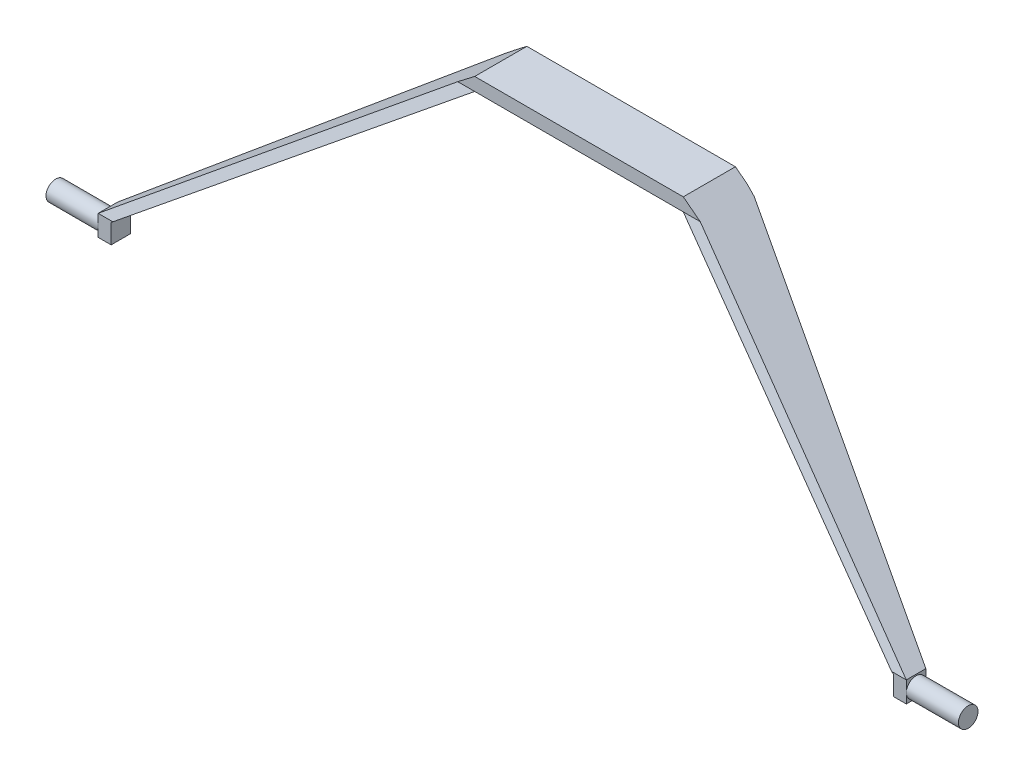
from build123d import *

# Parameters (mm, degrees)
BOSS_EXTRUDE1_DEPTH            = 11.43
BOSS_EXTRUDE1_DEPTH_BACK       = 101.6
CUT_EXTRUDE2_REACH             = 833.724
CUT_EXTRUDE2_DIRECTION_2_REACH = 833.724
CUT_EXTRUDE3_REACH             = 833.724
CUT_EXTRUDE3_DIRECTION_2_REACH = 833.724
BOSS_EXTRUDE3_DEPTH            = 149.606
SKETCH9_R                      = 19.05
BOSS_EXTRUDE4_DEPTH            = 101.6
CUT_EXTRUDE4_REACH             = 936.966
CUT_EXTRUDE4_DIRECTION_2_REACH = 936.966
CUT_EXTRUDE5_REACH             = 936.966
CUT_EXTRUDE5_DIRECTION_2_REACH = 936.966


with BuildPart() as part:
    # Sketch1 → Boss-Extrude1 (new, two sides: drawn at the far end of the back side and taken through both)
    with BuildSketch(Plane.XY.offset(-BOSS_EXTRUDE1_DEPTH_BACK)):
        Polygon((-787.4, -209.55), (-787.471663752, -247.65), (-762.071663752, -247.65), (-762.071663752, -209.55), (-203.2, 215.9), (0, 215.9), (0, 241.3), (-203.2, 241.3), (-787.4, -207.01), align=None)
        Polygon((0, 241.3), (0, 215.9), (203.2, 215.9), (762.071663752, -209.55), (762.071663752, -247.65), (787.471663752, -247.65), (787.4, -209.55), (787.4, -207.01), (203.2, 241.3), align=None)
    extrude(amount=BOSS_EXTRUDE1_DEPTH + BOSS_EXTRUDE1_DEPTH_BACK)

    # Sketch5 → Cut-Extrude2 (cut, up to next)
    with BuildSketch(Plane(origin=(0, 0, 0), x_dir=(0, 0, -1), z_dir=(1, 0, 0)), mode=Mode.PRIVATE) as cut_extrude2_sk1:
        Polygon((-11.43, -209.55), (0, 215.9), (0, 241.3), (-11.43, 241.3), (-11.43, 215.9), align=None)
    cut_extrude2_tool1 = extrude(cut_extrude2_sk1.sketch, amount=-CUT_EXTRUDE2_REACH, mode=Mode.PRIVATE) & part.part
    add(cut_extrude2_tool1.solids().sort_by_distance((0, 90.565111, 7.4168))[0], mode=Mode.SUBTRACT)

    # Sketch5 → Cut-Extrude2 direction 2 (cut, up to next)
    with BuildSketch(Plane(origin=(0, 0, 0), x_dir=(0, 0, -1), z_dir=(1, 0, 0)), mode=Mode.PRIVATE) as cut_extrude2_direction_2_sk1:
        Polygon((-11.43, -209.55), (0, 215.9), (0, 241.3), (-11.43, 241.3), (-11.43, 215.9), align=None)
    cut_extrude2_direction_2_tool1 = extrude(cut_extrude2_direction_2_sk1.sketch, amount=CUT_EXTRUDE2_DIRECTION_2_REACH, mode=Mode.PRIVATE) & part.part
    add(cut_extrude2_direction_2_tool1.solids().sort_by_distance((0, 90.565111, 7.4168))[0], mode=Mode.SUBTRACT)

    # Sketch7 → Cut-Extrude3 (cut, up to next)
    with BuildSketch(Plane(origin=(0, 0, 0), x_dir=(0, 0, -1), z_dir=(1, 0, 0)), mode=Mode.PRIVATE) as cut_extrude3_sk1:
        Polygon((26.67, -209.55), (101.6, 223.982414479), (101.6, -247.65), (26.67, -247.65), align=None)
    cut_extrude3_tool1 = extrude(cut_extrude3_sk1.sketch, amount=-CUT_EXTRUDE3_REACH, mode=Mode.PRIVATE) & part.part
    add(cut_extrude3_tool1.solids().sort_by_distance((0, -89.489932, -74.75645))[0], mode=Mode.SUBTRACT)

    # Sketch7 → Cut-Extrude3 direction 2 (cut, up to next)
    with BuildSketch(Plane(origin=(0, 0, 0), x_dir=(0, 0, -1), z_dir=(1, 0, 0)), mode=Mode.PRIVATE) as cut_extrude3_direction_2_sk1:
        Polygon((26.67, -209.55), (101.6, 223.982414479), (101.6, -247.65), (26.67, -247.65), align=None)
    cut_extrude3_direction_2_tool1 = extrude(cut_extrude3_direction_2_sk1.sketch, amount=CUT_EXTRUDE3_DIRECTION_2_REACH, mode=Mode.PRIVATE) & part.part
    add(cut_extrude3_direction_2_tool1.solids().sort_by_distance((0, -89.489932, -74.75645))[0], mode=Mode.SUBTRACT)

    # Sketch8 → Boss-Extrude3 (add)
    with BuildSketch(Plane.XY):
        Polygon((-787.471663752, -247.65), (-762.071663752, -247.65), (-762.071663752, -209.55), (-203.2, 215.9), (203.2, 215.9), (762.071663752, -209.55), (762.071663752, -247.65), (787.471663752, -247.65), (787.4, -207.01), (203.2, 241.3), (-203.2, 241.3), (-787.4, -207.01), align=None)
    extrude(amount=BOSS_EXTRUDE3_DEPTH)

    # Sketch9 → Boss-Extrude4 (add)
    with BuildSketch(Plane(origin=(787.032515479, 1.387837182, 0), x_dir=(0, 0, -1), z_dir=(0.9999984452495948, 0.0017633769855495952, 0))):
        with Locations(Location((-130.556, -229.988224375, 0), (0, 0, 270))):
            Circle(SKETCH9_R)
    boss_extrude4 = extrude(amount=BOSS_EXTRUDE4_DEPTH)

    # Mirror1: Boss-Extrude4 across plane
    add(boss_extrude4.mirror(Plane(origin=(0, 0, 0), x_dir=(0, 0, 1), z_dir=(1, 0, 0))))

    # Cut-Extrude4: up to this face of the body (flat: up to its plane)
    cut_extrude4_end = Plane(part.part.faces().sort_by_distance((-477.863853052, 30.525347549, 40.754880745))[0])
    # Sketch10 → Cut-Extrude4 (cut, up to the picked face)
    with BuildSketch(Plane(origin=(0, 0, 0), x_dir=(0, 0, -1), z_dir=(1, 0, 0)), mode=Mode.PRIVATE) as cut_extrude4_sk1:
        Polygon((-111.506, -207.01), (-111.506, -247.65), (101.6, -247.65), (101.6, 215.9), align=None)
    cut_extrude4_tool1 = split(extrude(cut_extrude4_sk1.sketch, amount=-CUT_EXTRUDE4_REACH, mode=Mode.PRIVATE), bisect_by=cut_extrude4_end, keep=Keep.BOTH, mode=Mode.PRIVATE)
    add(cut_extrude4_tool1.solids().sort_by(Axis((0, -92.041411, -24.838897), (-1, 0, 0)))[0], mode=Mode.SUBTRACT)

    # Cut-Extrude4 direction 2: up to this face of the body (flat: up to its plane)
    cut_extrude4_direction_2_end = Plane(part.part.faces().sort_by_distance((477.863853052, 30.525347549, 40.754880745))[0])
    # Sketch10 → Cut-Extrude4 direction 2 (cut, up to the picked face)
    with BuildSketch(Plane(origin=(0, 0, 0), x_dir=(0, 0, -1), z_dir=(1, 0, 0)), mode=Mode.PRIVATE) as cut_extrude4_direction_2_sk1:
        Polygon((-111.506, -207.01), (-111.506, -247.65), (101.6, -247.65), (101.6, 215.9), align=None)
    cut_extrude4_direction_2_tool1 = split(extrude(cut_extrude4_direction_2_sk1.sketch, amount=CUT_EXTRUDE4_DIRECTION_2_REACH, mode=Mode.PRIVATE), bisect_by=cut_extrude4_direction_2_end, keep=Keep.BOTH, mode=Mode.PRIVATE)
    add(cut_extrude4_direction_2_tool1.solids().sort_by(Axis((0, -92.041411, -24.838897), (1, 0, 0)))[0], mode=Mode.SUBTRACT)

    # Cut-Extrude5: up to this plane
    cut_extrude5_end = Plane(origin=(-191.85340904, 250.007275237, 11.43), z_dir=(-0.6087935435147127, 0.7933286969313537, 0))
    # Sketch11 → Cut-Extrude5 (cut, up to the surface)
    with BuildSketch(Plane(origin=(0, 0, 0), x_dir=(0, 0, -1), z_dir=(1, 0, 0)), mode=Mode.PRIVATE) as cut_extrude5_sk1:
        Polygon((0, 241.3), (-149.606, 241.3), (-149.606, -207.01), (0, 215.9), align=None)
    cut_extrude5_tool1 = split(extrude(cut_extrude5_sk1.sketch, amount=-CUT_EXTRUDE5_REACH, mode=Mode.PRIVATE), bisect_by=cut_extrude5_end, keep=Keep.BOTH, mode=Mode.PRIVATE)
    add(cut_extrude5_tool1.solids().sort_by_distance((0, 91.409357, 97.06341))[0], mode=Mode.SUBTRACT)

    # Cut-Extrude5 direction 2: up to this plane
    cut_extrude5_direction_2_end = Plane(origin=(191.85340904, 250.007275237, 11.43), z_dir=(-0.608793543514713, -0.7933286969313534, 0))
    # Sketch11 → Cut-Extrude5 direction 2 (cut, up to the surface)
    with BuildSketch(Plane(origin=(0, 0, 0), x_dir=(0, 0, -1), z_dir=(1, 0, 0)), mode=Mode.PRIVATE) as cut_extrude5_direction_2_sk1:
        Polygon((0, 241.3), (-149.606, 241.3), (-149.606, -207.01), (0, 215.9), align=None)
    cut_extrude5_direction_2_tool1 = split(extrude(cut_extrude5_direction_2_sk1.sketch, amount=CUT_EXTRUDE5_DIRECTION_2_REACH, mode=Mode.PRIVATE), bisect_by=cut_extrude5_direction_2_end, keep=Keep.BOTH, mode=Mode.PRIVATE)
    add(cut_extrude5_direction_2_tool1.solids().sort_by_distance((0, 91.409357, 97.06341))[0], mode=Mode.SUBTRACT)


solid = part.part
